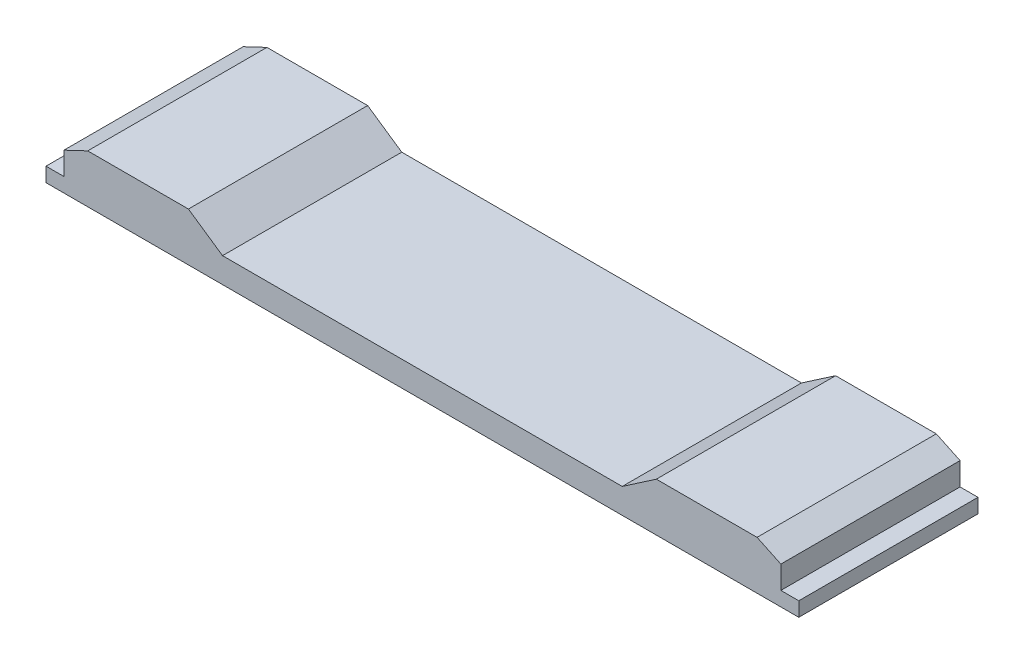
from build123d import *

# Parameters (mm, degrees)
EXTRUDE_1_DEPTH = 10


with BuildPart() as part:
    # Эскиз1 → Бобышка-Вытянуть1 (new body)
    with BuildSketch(Plane.XY):
        Polygon((20, 26.33), (21, 26.33), (21, 27.13), (20, 27.13), (20, 28.402997345), (18.673455449, 29.032039108), (13.053740811, 29.032039108), (11.150760576, 27.73), (-11.150760576, 27.73), (-13.053740811, 29.032039108), (-18.673455449, 29.032039108), (-20, 28.402997345), (-20, 27.13), (-21, 27.13), (-21, 26.33), (-20, 26.33), align=None)
    extrude(amount=EXTRUDE_1_DEPTH)


solid = part.part
